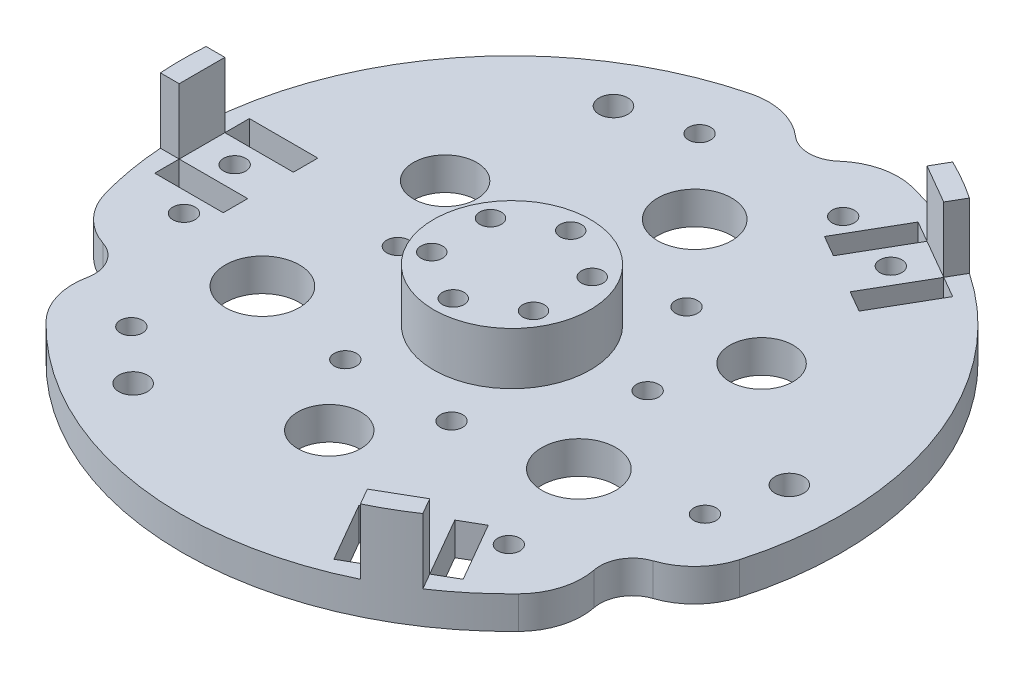
from build123d import *

# Parameters (mm, degrees)
SKETCH1_R                = 50.5
BOSS_EXTRUDE1_DEPTH      = 5
SKETCH3_R                = 12
SKETCH3_R_2              = 1.65
BOSS_EXTRUDE2_DEPTH      = 8
CUT_EXTRUDE6_REACH       = 73.864
SKETCH9_R                = 5.675
SKETCH9_R_2              = 1.7
CIRPATTERN1_COUNT        = 3
SKETCH10_R               = 4.85
CUT_EXTRUDE7_DEPTH       = 72.864455748
SKETCH11_R               = 1.7
CUT_EXTRUDE8_DEPTH       = 72.864455748
CUT_EXTRUDE9_REACH       = 73.864
SKETCH13_R               = 2.2
CIRPATTERN2_COUNT        = 3
CUT_EXTRUDE11_DEPTH      = 72.864455748
BOSS_EXTRUDE3_DEPTH      = 10
CIRPATTERN3_COUNT        = 3
CUT_EXTRUDE12_DEPTH      = 73.114492302
FILLET1_R                = 10
CIRPATTERN4_COUNT        = 3
FILLET1_OF_CIRPATTERN4_R = 10


with BuildPart() as part:
    # Sketch1 → Boss-Extrude1 (new body)
    with BuildSketch(Plane(origin=(0, 0, 0), x_dir=(1, 0, 0), z_dir=(0, 1, 0))):
        Circle(SKETCH1_R)
    extrude(amount=BOSS_EXTRUDE1_DEPTH)

    # Sketch3 → Boss-Extrude2 (add)
    with BuildSketch(Plane(origin=(0, 5, 0), x_dir=(1, 0, 0), z_dir=(0, 1, 0))):
        Circle(SKETCH3_R)
        with Locations((0, 9)):
            Circle(SKETCH3_R_2, mode=Mode.SUBTRACT)
        with Locations((7.794228634, 4.5)):
            Circle(SKETCH3_R_2, mode=Mode.SUBTRACT)
        with Locations((7.794228634, -4.5)):
            Circle(SKETCH3_R_2, mode=Mode.SUBTRACT)
        with Locations((0, -9)):
            Circle(SKETCH3_R_2, mode=Mode.SUBTRACT)
        with Locations((-7.794228634, -4.5)):
            Circle(SKETCH3_R_2, mode=Mode.SUBTRACT)
        with Locations((-7.794228634, 4.5)):
            Circle(SKETCH3_R_2, mode=Mode.SUBTRACT)
    extrude(amount=BOSS_EXTRUDE2_DEPTH)

    # Sketch9 → Cut-Extrude6 (cut, up to next)
    with BuildSketch(Plane(origin=(0, 5, 0), x_dir=(1, 0, 0), z_dir=(0, 1, 0)), mode=Mode.PRIVATE) as cut_extrude6_sk1:
        with Locations((0, 28)):
            Circle(SKETCH9_R)
    cut_extrude6_tool1 = extrude(cut_extrude6_sk1.sketch, amount=-CUT_EXTRUDE6_REACH, mode=Mode.PRIVATE) & part.part
    # Sketch9 → Cut-Extrude6 (cut, up to next)
    with BuildSketch(Plane(origin=(0, 5, 0), x_dir=(1, 0, 0), z_dir=(0, 1, 0)), mode=Mode.PRIVATE) as cut_extrude6_sk2:
        with Locations((11, 15.75)):
            Circle(SKETCH9_R_2)
    cut_extrude6_tool2 = extrude(cut_extrude6_sk2.sketch, amount=-CUT_EXTRUDE6_REACH, mode=Mode.PRIVATE) & part.part
    # Sketch9 → Cut-Extrude6 (cut, up to next)
    with BuildSketch(Plane(origin=(0, 5, 0), x_dir=(1, 0, 0), z_dir=(0, 1, 0)), mode=Mode.PRIVATE) as cut_extrude6_sk3:
        with Locations((-11, 15.75)):
            Circle(SKETCH9_R_2)
    cut_extrude6_tool3 = extrude(cut_extrude6_sk3.sketch, amount=-CUT_EXTRUDE6_REACH, mode=Mode.PRIVATE) & part.part
    # Sketch9 → Cut-Extrude6 (cut, up to next)
    with BuildSketch(Plane(origin=(0, 5, 0), x_dir=(1, 0, 0), z_dir=(0, 1, 0)), mode=Mode.PRIVATE) as cut_extrude6_sk4:
        with Locations((11, 39.75)):
            Circle(SKETCH9_R_2)
    cut_extrude6_tool4 = extrude(cut_extrude6_sk4.sketch, amount=-CUT_EXTRUDE6_REACH, mode=Mode.PRIVATE) & part.part
    # Sketch9 → Cut-Extrude6 (cut, up to next)
    with BuildSketch(Plane(origin=(0, 5, 0), x_dir=(1, 0, 0), z_dir=(0, 1, 0)), mode=Mode.PRIVATE) as cut_extrude6_sk5:
        with Locations((-11, 39.75)):
            Circle(SKETCH9_R_2)
    cut_extrude6_tool5 = extrude(cut_extrude6_sk5.sketch, amount=-CUT_EXTRUDE6_REACH, mode=Mode.PRIVATE) & part.part
    cut_extrude6_1 = cut_extrude6_tool1.solids().sort_by_distance((0, 5, -28))[0]
    add(cut_extrude6_1, mode=Mode.SUBTRACT)
    cut_extrude6_2 = cut_extrude6_tool2.solids().sort_by_distance((11, 5, -15.75))[0]
    add(cut_extrude6_2, mode=Mode.SUBTRACT)
    cut_extrude6_3 = cut_extrude6_tool3.solids().sort_by_distance((-11, 5, -15.75))[0]
    add(cut_extrude6_3, mode=Mode.SUBTRACT)
    cut_extrude6_4 = cut_extrude6_tool4.solids().sort_by_distance((11, 5, -39.75))[0]
    add(cut_extrude6_4, mode=Mode.SUBTRACT)
    cut_extrude6_5 = cut_extrude6_tool5.solids().sort_by_distance((-11, 5, -39.75))[0]
    add(cut_extrude6_5, mode=Mode.SUBTRACT)
    cut_extrude6 = cut_extrude6_1 + cut_extrude6_2 + cut_extrude6_3 + cut_extrude6_4 + cut_extrude6_5  # Cut-Extrude6 as one shape, for the pattern or mirror that repeats it

    # CirPattern1: Cut-Extrude6 ×3 about axis
    cirpattern1_axis = Axis((0, 15.75, 0), (0, -1, 0))
    for i in range(1, CIRPATTERN1_COUNT):
        add(cut_extrude6.rotate(cirpattern1_axis, i * 360 / CIRPATTERN1_COUNT), mode=Mode.SUBTRACT)

    # Sketch10 → Cut-Extrude7 (cut, through all)
    with BuildSketch(Plane(origin=(0, 5, 0), x_dir=(1, 0, 0), z_dir=(0, 1, 0))):
        with Locations((-24.248711306, 14)):
            Circle(SKETCH10_R)
        with Locations((24.248711306, 14)):
            Circle(SKETCH10_R)
        with Locations((0, -28)):
            Circle(SKETCH10_R)
    extrude(amount=-CUT_EXTRUDE7_DEPTH, mode=Mode.SUBTRACT)

    # Sketch11 → Cut-Extrude8 (cut, through all)
    with BuildSketch(Plane(origin=(0, 5, 0), x_dir=(1, 0, 0), z_dir=(0, 1, 0))):
        with Locations((21.25, 36.806079661)):
            Circle(SKETCH11_R)
    cut_extrude8 = extrude(amount=-CUT_EXTRUDE8_DEPTH, mode=Mode.SUBTRACT)

    # Sketch13 → Cut-Extrude9 (cut, up to next)
    with BuildSketch(Plane(origin=(0, 5, 0), x_dir=(1, 0, 0), z_dir=(0, 1, 0)), mode=Mode.PRIVATE) as cut_extrude9_sk1:
        with Locations((-21.25, 36.806079661)):
            Circle(SKETCH13_R)
    cut_extrude9_tool1 = extrude(cut_extrude9_sk1.sketch, amount=-CUT_EXTRUDE9_REACH, mode=Mode.PRIVATE) & part.part
    cut_extrude9 = cut_extrude9_tool1.solids().sort_by_distance((-21.25, 5, -36.80608))[0]
    add(cut_extrude9, mode=Mode.SUBTRACT)

    # CirPattern2: Cut-Extrude8, Cut-Extrude9 ×3 about axis
    cirpattern2_axis = Axis((0, 15.75, 0), (0, -1, 0))
    add([cut_extrude8.rotate(cirpattern2_axis, i * 360 / CIRPATTERN2_COUNT) for i in range(1, CIRPATTERN2_COUNT)], mode=Mode.SUBTRACT)
    add([cut_extrude9.rotate(cirpattern2_axis, i * 360 / CIRPATTERN2_COUNT) for i in range(1, CIRPATTERN2_COUNT)], mode=Mode.SUBTRACT)

    # Sketch15 → Cut-Extrude11 (cut, through all)
    with BuildSketch(Plane(origin=(0, 5, 0), x_dir=(1, 0, 0), z_dir=(0, 1, 0))):
        Polygon((20.718911087, 42.88620668), (17.471315823, 44.76120668), (12.221315823, 35.66793994), (15.468911087, 33.79293994), align=None)
        Polygon((26.781088913, 39.38620668), (30.028684177, 37.51120668), (24.778684177, 28.41793994), (21.531088913, 30.29293994), align=None)
    cut_extrude11 = extrude(amount=-CUT_EXTRUDE11_DEPTH, mode=Mode.SUBTRACT)

    # Sketch17 → Boss-Extrude3 (add)
    with BuildSketch(Plane(origin=(0, 5, 0), x_dir=(1, 0, 0), z_dir=(0, 1, 0))):
        with BuildLine():
            Line((20.718911087, 42.88620668), (26.781088913, 39.38620668))
            Line((26.781088913, 39.38620668), (28.220372349, 41.879118717))
            ThreePointArc((28.220372349, 41.879118717), (25.25, 43.734282891), (22.158194522, 45.379118717))
            Line((22.158194522, 45.379118717), (20.718911087, 42.88620668))
        make_face()
    boss_extrude3 = extrude(amount=BOSS_EXTRUDE3_DEPTH)

    # CirPattern3: Cut-Extrude11, Boss-Extrude3 ×3 about axis
    cirpattern3_axis = Axis((0, 15.75, 0), (0, -1, 0))
    add([cut_extrude11.rotate(cirpattern3_axis, i * 360 / CIRPATTERN3_COUNT) for i in range(1, CIRPATTERN3_COUNT)], mode=Mode.SUBTRACT)
    add([boss_extrude3.rotate(cirpattern3_axis, i * 360 / CIRPATTERN3_COUNT) for i in range(1, CIRPATTERN3_COUNT)])

    # Sketch18 → Cut-Extrude12 (cut, through all)
    with BuildSketch(Plane(origin=(0, 5, 0), x_dir=(1, 0, 0), z_dir=(0, 1, 0))):
        with BuildLine():
            ThreePointArc((41.022985472, -29.45105538), (43.734282891, -25.25), (46.016854863, -20.801419868))
            ThreePointArc((46.016854863, -20.801419868), (39.404155872, -22.75), (41.022985472, -29.45105538))
        make_face()
    cut_extrude12 = extrude(amount=-CUT_EXTRUDE12_DEPTH, mode=Mode.SUBTRACT)

    # Fillet1
    fillet1_edges = [part.edges().sort_by_distance(p)[0] for p in [
        (46.016854863, 2.5, 20.801419868),
        (41.022985472, 2.5, 29.45105538),
    ]]
    fillet(fillet1_edges, radius=FILLET1_R)

    # CirPattern4: Cut-Extrude12 ×3 about axis
    cirpattern4_axis = Axis((0, 15.75, 0), (0, -1, 0))
    for i in range(1, CIRPATTERN4_COUNT):
        add(cut_extrude12.rotate(cirpattern4_axis, i * 360 / CIRPATTERN4_COUNT), mode=Mode.SUBTRACT)

    # Fillet1 of CirPattern4
    fillet1_of_cirpattern4_edges = [part.edges().sort_by_distance(p)[0] for p in [
        (-41.022985472, 2.5, 29.45105538),
        (-46.016854863, 2.5, 20.801419868),
        (-4.993869391, 2.5, -50.252475248),
        (4.993869391, 2.5, -50.252475248),
    ]]
    fillet(fillet1_of_cirpattern4_edges, radius=FILLET1_OF_CIRPATTERN4_R)


solid = part.part
